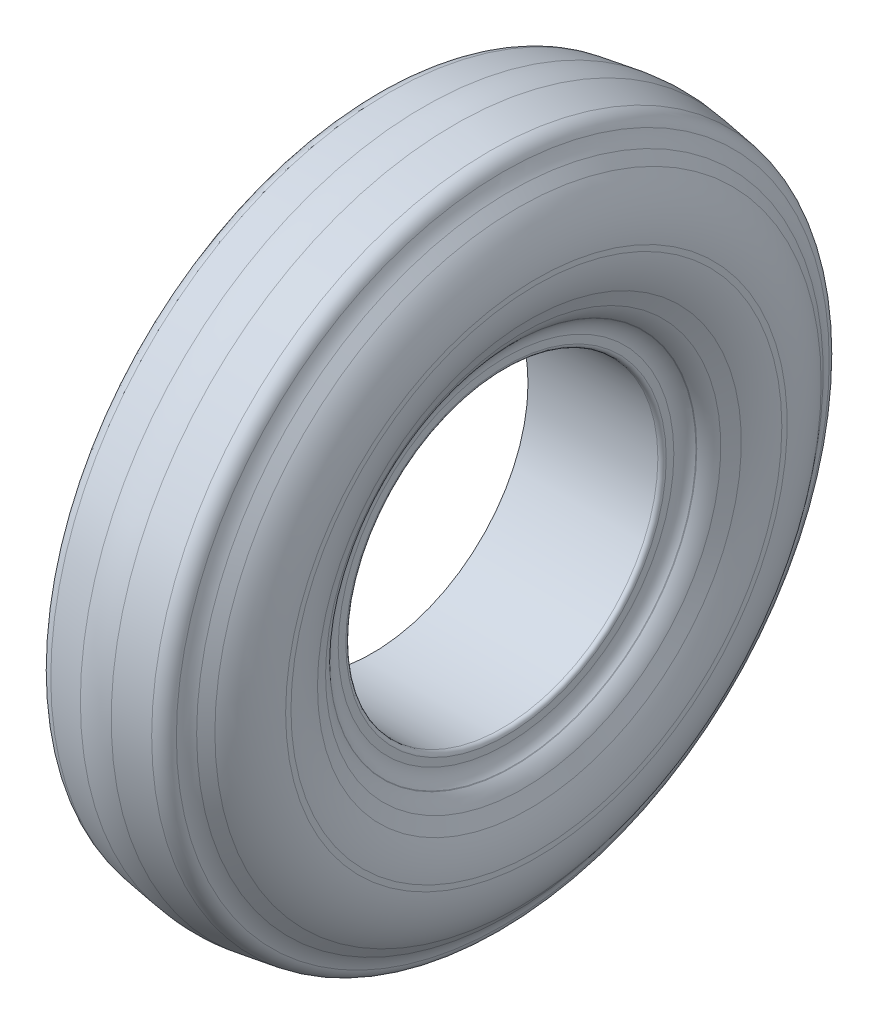
from build123d import *

# Parameters (mm, degrees)
FILLET1_R = 12.7
FILLET2_R = 25.4
FILLET3_R = 50.8
FILLET4_R = 50.8
FILLET5_R = 25.4
FILLET6_R = 10.16
FILLET7_R = 60.96
FILLET8_R = 2.54


with BuildPart() as part:
    # Sketch2 → Revolve2 (revolve)
    with BuildSketch(Plane.XY, mode=Mode.PRIVATE) as revolve2_sk:
        Polygon((40.64, 94.615), (40.64, 107.315), (48.895, 114.935), (59.055, 138.21448453), (59.055, 169.881557626), (40.005, 193.675), (36.83, 203.835), (0, 209.55), (-36.83, 203.835), (-40.005, 193.675), (-59.055, 169.881557626), (-59.055, 138.21448453), (-48.895, 114.935), (-40.64, 107.315), (-40.64, 94.615), align=None)
    revolve(revolve2_sk.sketch.rotate(Axis((0, 0, 0), (1, 0, 0)), 90), axis=Axis((0, 0, 0), (1, 0, 0)))

    # Fillet1
    fillet1_edges = [part.edges().sort_by_distance(p)[0] for p in [
        (40.64, 0, -107.315),
        (-40.64, 0, -107.315),
    ]]
    fillet(fillet1_edges, radius=FILLET1_R)

    # Fillet2
    fillet2_edges = [part.edges().sort_by_distance(p)[0] for p in [
        (48.895, 0, -114.935),
        (-48.895, 0, -114.935),
    ]]
    fillet(fillet2_edges, radius=FILLET2_R)

    # Fillet3
    fillet3_edges = [part.edges().sort_by_distance(p)[0] for p in [
        (59.055, 0, -138.21448453),
        (-59.055, 0, -138.21448453),
    ]]
    fillet(fillet3_edges, radius=FILLET3_R)

    # Fillet4
    fillet4_edges = [part.edges().sort_by_distance(p)[0] for p in [
        (59.055, 0, -169.881557626),
        (-59.055, 0, -169.881557626),
    ]]
    fillet(fillet4_edges, radius=FILLET4_R)

    # Fillet5
    fillet5_edges = [part.edges().sort_by_distance(p)[0] for p in [
        (40.005, 0, -193.675),
        (-40.005, 0, -193.675),
    ]]
    fillet(fillet5_edges, radius=FILLET5_R)

    # Fillet6
    fillet6_edges = [part.edges().sort_by_distance(p)[0] for p in [
        (36.83, 0, -203.835),
        (-36.83, 0, -203.835),
    ]]
    fillet(fillet6_edges, radius=FILLET6_R)

    # Fillet7
    fillet7_edges = [part.edges().sort_by_distance(p)[0] for p in [
        (0, 0, -209.55),
    ]]
    fillet(fillet7_edges, radius=FILLET7_R)

    # Fillet8
    fillet8_edges = [part.edges().sort_by_distance(p)[0] for p in [
        (40.64, 0, -94.615),
    ]]
    fillet(fillet8_edges, radius=FILLET8_R)


solid = part.part
